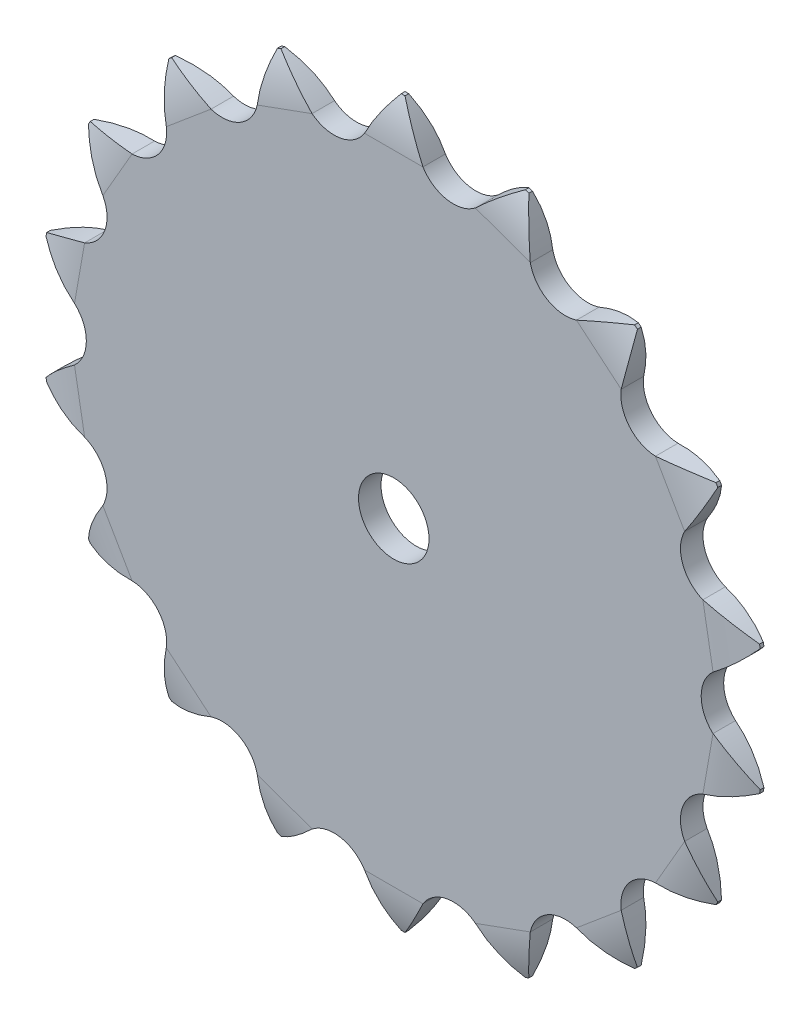
from build123d import *

# Parameters (mm, degrees)
EXTRUDE_1_DEPTH          = 1.5
CUT_EXTRUDE_1_DEPTH      = 25
PATTERN_CIRCULAR_1_COUNT = 18
SKETCH_7_R               = 41
SKETCH_7_R_2             = 4.7
EXTRUDE_2_DEPTH          = 1.5


with BuildPart() as part:
    # 草图5 → 凸台-拉伸1 (new, symmetric)
    with BuildSketch(Plane.XY):
        with BuildLine():
            ThreePointArc((7.119575284, 40.377117874), (0, 41), (-7.119575284, 40.377117874))
            ThreePointArc((-7.119575284, 40.377117874), (-5.276416951, 41.120387695), (-3.893038698, 42.547253939))
            ThreePointArc((-3.893038698, 42.547253939), (-2.227688179, 45.53041811), (-0.25, 48.316348886))
            Line((-0.25, 48.316348886), (0.25, 48.316348886))
            ThreePointArc((0.25, 48.316348886), (2.227688179, 45.53041811), (3.893038698, 42.547253939))
            ThreePointArc((3.893038698, 42.547253939), (5.276416951, 41.120387695), (7.119575284, 40.377117874))
        make_face()
    extrude(amount=EXTRUDE_1_DEPTH, both=True)

    # 草图6 → 切除-拉伸1 (cut, symmetric)
    with BuildSketch(Plane(origin=(0, 0, 0), x_dir=(0, 0, -1), z_dir=(1, 0, 0))):
        with BuildLine():
            Line((1.5, 42.547253939), (3.391332149, 42.547253939))
            Line((3.391332149, 42.547253939), (3.391332149, 49.722853059))
            Line((3.391332149, 49.722853059), (-3.391332149, 49.722853059))
            Line((-3.391332149, 49.722853059), (-3.391332149, 42.547253939))
            Line((-3.391332149, 42.547253939), (-1.5, 42.547253939))
            ThreePointArc((-1.5, 42.547253939), (-1.151380639, 45.491685294), (-0.25, 48.316348886))
            Line((-0.25, 48.316348886), (0.25, 48.316348886))
            ThreePointArc((0.25, 48.316348886), (1.151380639, 45.491685294), (1.5, 42.547253939))
        make_face()
    extrude(amount=CUT_EXTRUDE_1_DEPTH, both=True, mode=Mode.SUBTRACT)


with BuildPart() as pattern_circular_1_1:
    # 阵列(圆周)1: pattern copy
    add(part.part.rotate(Axis((0, 0, 0), (0, 0, 1)), 1 * 360 / PATTERN_CIRCULAR_1_COUNT))


with BuildPart() as pattern_circular_1_2:
    # 阵列(圆周)1: pattern copy
    add(part.part.rotate(Axis((0, 0, 0), (0, 0, 1)), 2 * 360 / PATTERN_CIRCULAR_1_COUNT))


with BuildPart() as pattern_circular_1_3:
    # 阵列(圆周)1: pattern copy
    add(part.part.rotate(Axis((0, 0, 0), (0, 0, 1)), 3 * 360 / PATTERN_CIRCULAR_1_COUNT))


with BuildPart() as pattern_circular_1_4:
    # 阵列(圆周)1: pattern copy
    add(part.part.rotate(Axis((0, 0, 0), (0, 0, 1)), 4 * 360 / PATTERN_CIRCULAR_1_COUNT))


with BuildPart() as pattern_circular_1_5:
    # 阵列(圆周)1: pattern copy
    add(part.part.rotate(Axis((0, 0, 0), (0, 0, 1)), 5 * 360 / PATTERN_CIRCULAR_1_COUNT))


with BuildPart() as pattern_circular_1_6:
    # 阵列(圆周)1: pattern copy
    add(part.part.rotate(Axis((0, 0, 0), (0, 0, 1)), 6 * 360 / PATTERN_CIRCULAR_1_COUNT))


with BuildPart() as pattern_circular_1_7:
    # 阵列(圆周)1: pattern copy
    add(part.part.rotate(Axis((0, 0, 0), (0, 0, 1)), 7 * 360 / PATTERN_CIRCULAR_1_COUNT))


with BuildPart() as pattern_circular_1_8:
    # 阵列(圆周)1: pattern copy
    add(part.part.rotate(Axis((0, 0, 0), (0, 0, 1)), 8 * 360 / PATTERN_CIRCULAR_1_COUNT))


with BuildPart() as pattern_circular_1_9:
    # 阵列(圆周)1: pattern copy
    add(part.part.rotate(Axis((0, 0, 0), (0, 0, 1)), 9 * 360 / PATTERN_CIRCULAR_1_COUNT))


with BuildPart() as pattern_circular_1_10:
    # 阵列(圆周)1: pattern copy
    add(part.part.rotate(Axis((0, 0, 0), (0, 0, 1)), 10 * 360 / PATTERN_CIRCULAR_1_COUNT))


with BuildPart() as pattern_circular_1_11:
    # 阵列(圆周)1: pattern copy
    add(part.part.rotate(Axis((0, 0, 0), (0, 0, 1)), 11 * 360 / PATTERN_CIRCULAR_1_COUNT))


with BuildPart() as pattern_circular_1_12:
    # 阵列(圆周)1: pattern copy
    add(part.part.rotate(Axis((0, 0, 0), (0, 0, 1)), 12 * 360 / PATTERN_CIRCULAR_1_COUNT))


with BuildPart() as pattern_circular_1_13:
    # 阵列(圆周)1: pattern copy
    add(part.part.rotate(Axis((0, 0, 0), (0, 0, 1)), 13 * 360 / PATTERN_CIRCULAR_1_COUNT))


with BuildPart() as pattern_circular_1_14:
    # 阵列(圆周)1: pattern copy
    add(part.part.rotate(Axis((0, 0, 0), (0, 0, 1)), 14 * 360 / PATTERN_CIRCULAR_1_COUNT))


with BuildPart() as pattern_circular_1_15:
    # 阵列(圆周)1: pattern copy
    add(part.part.rotate(Axis((0, 0, 0), (0, 0, 1)), 15 * 360 / PATTERN_CIRCULAR_1_COUNT))


with BuildPart() as pattern_circular_1_16:
    # 阵列(圆周)1: pattern copy
    add(part.part.rotate(Axis((0, 0, 0), (0, 0, 1)), 16 * 360 / PATTERN_CIRCULAR_1_COUNT))


with BuildPart() as pattern_circular_1_17:
    # 阵列(圆周)1: pattern copy
    add(part.part.rotate(Axis((0, 0, 0), (0, 0, 1)), 17 * 360 / PATTERN_CIRCULAR_1_COUNT))


with BuildPart() as part_1:
    add(part.part)

    add(pattern_circular_1_1.part)  # 凸台-拉伸2 merges 阵列(圆周)1_1

    add(pattern_circular_1_2.part)  # 凸台-拉伸2 merges 阵列(圆周)1_2

    add(pattern_circular_1_3.part)  # 凸台-拉伸2 merges 阵列(圆周)1_3

    add(pattern_circular_1_4.part)  # 凸台-拉伸2 merges 阵列(圆周)1_4

    add(pattern_circular_1_5.part)  # 凸台-拉伸2 merges 阵列(圆周)1_5

    add(pattern_circular_1_6.part)  # 凸台-拉伸2 merges 阵列(圆周)1_6

    add(pattern_circular_1_7.part)  # 凸台-拉伸2 merges 阵列(圆周)1_7

    add(pattern_circular_1_8.part)  # 凸台-拉伸2 merges 阵列(圆周)1_8

    add(pattern_circular_1_9.part)  # 凸台-拉伸2 merges 阵列(圆周)1_9

    add(pattern_circular_1_10.part)  # 凸台-拉伸2 merges 阵列(圆周)1_10

    add(pattern_circular_1_11.part)  # 凸台-拉伸2 merges 阵列(圆周)1_11

    add(pattern_circular_1_12.part)  # 凸台-拉伸2 merges 阵列(圆周)1_12

    add(pattern_circular_1_13.part)  # 凸台-拉伸2 merges 阵列(圆周)1_13

    add(pattern_circular_1_14.part)  # 凸台-拉伸2 merges 阵列(圆周)1_14

    add(pattern_circular_1_15.part)  # 凸台-拉伸2 merges 阵列(圆周)1_15

    add(pattern_circular_1_16.part)  # 凸台-拉伸2 merges 阵列(圆周)1_16

    add(pattern_circular_1_17.part)  # 凸台-拉伸2 merges 阵列(圆周)1_17
    # 草图7 → 凸台-拉伸2 (add, symmetric)
    with BuildSketch(Plane.XY):
        Circle(SKETCH_7_R)
        Circle(SKETCH_7_R_2, mode=Mode.SUBTRACT)
    extrude(amount=EXTRUDE_2_DEPTH, both=True)


solid = part_1.part
